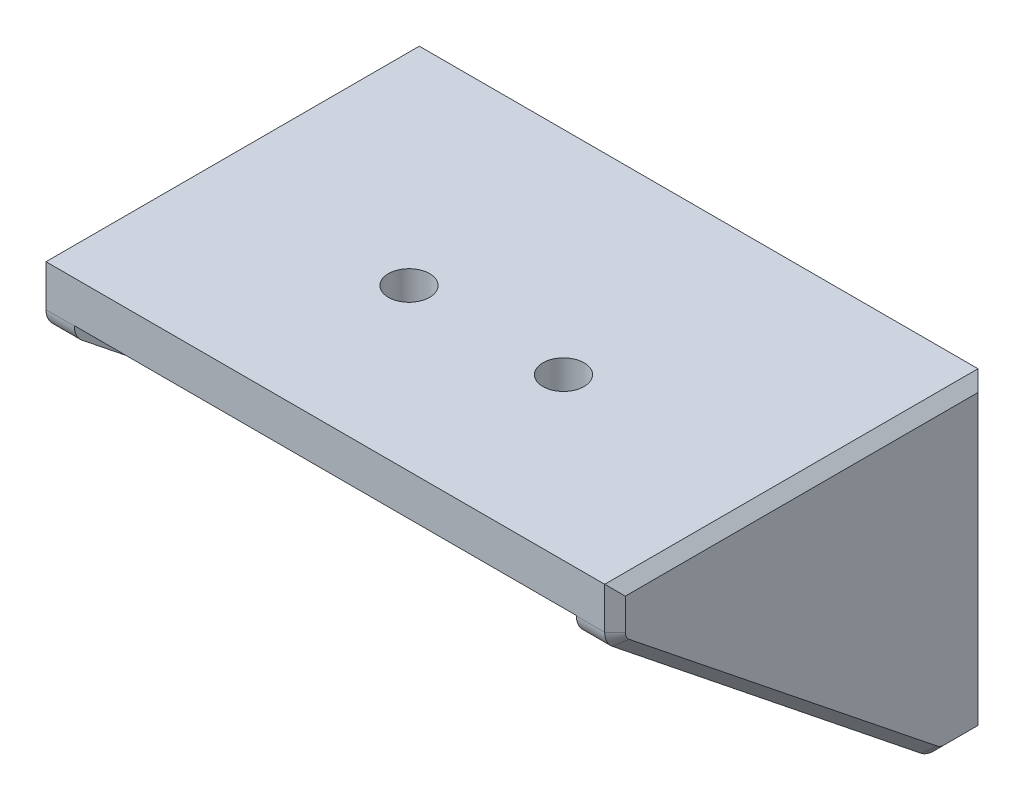
from build123d import *

# Parameters (mm, degrees)
SKETCH_1_W          = 39
SKETCH_1_H          = 29
SKETCH_1_R          = 1.6
EXTRUDE_1_DEPTH     = 4
SKETCH_2_W          = 39
SKETCH_2_H          = 4
EXTRUDE_2_DEPTH     = 20
SKETCH_3_R          = 1.35
CUT_EXTRUDE_1_DEPTH = 4
EXTRUDE_3_DEPTH     = 3
CHAMFER_1_SIZE      = 0.8
FILLET_1_R          = 1.6
CHAMFER_3_SIZE      = 0.8


with BuildPart() as part:
    # 草图1 → 凸台-拉伸1 (new body)
    with BuildSketch(Plane(origin=(0, 0, 0), x_dir=(1, 0, 0), z_dir=(0, 1, 0))):
        Rectangle(SKETCH_1_W, SKETCH_1_H)
        with Locations(Location((-6, -2, 0), (0, 0, 270))):
            Circle(SKETCH_1_R, mode=Mode.SUBTRACT)
        with Locations(Location((6, -2, 0), (0, 0, 90))):
            Circle(SKETCH_1_R, mode=Mode.SUBTRACT)
    extrude(amount=EXTRUDE_1_DEPTH)

    # 草图2 → 凸台-拉伸2 (add)
    with BuildSketch(Plane(origin=(0, 0, 0), x_dir=(-1, 0, 0), z_dir=(0, -1, 0))):
        with Locations((0, 12.5)):
            Rectangle(SKETCH_2_W, SKETCH_2_H)
    extrude(amount=EXTRUDE_2_DEPTH)

    # 草图3 → 切除-拉伸1 (cut)
    with BuildSketch(Plane.XY.offset(-10.5)):
        with Locations((16, -4)):
            Circle(SKETCH_3_R)
        with Locations(Location((16, -16, 0), (0, 0, 180))):
            Circle(SKETCH_3_R)
        with Locations((-16, -16)):
            Circle(SKETCH_3_R)
        with Locations(Location((-16, -4, 0), (0, 0, 180))):
            Circle(SKETCH_3_R)
    extrude(amount=-CUT_EXTRUDE_1_DEPTH, mode=Mode.SUBTRACT)

    # 草图4 → 凸台-拉伸3 (add)
    with BuildSketch(Plane(origin=(19.5, 0, 0), x_dir=(0, 0, -1), z_dir=(1, 0, 0))):
        Polygon((-14.5, 0), (10.5, -20), (14.5, -20), (14.5, 4), (-14.5, 4), align=None)
    extrude_3 = extrude(amount=EXTRUDE_3_DEPTH)

    # 镜向1: 凸台-拉伸3 across plane
    add(extrude_3.mirror(Plane(origin=(0, 0, 0), x_dir=(0, 0, 1), z_dir=(1, 0, 0))))

    # 倒角1
    chamfer_1_edges = [part.edges().sort_by_distance(p)[0] for p in [
        (0, -20, -10.5),
        (0, -20, -14.5),
        (0, 0, 14.5),
        (22.5, -8, -14.5),
        (22.5, 4, 0),
        (-22.5, 4, 0),
        (-22.5, -8, -14.5),
    ]]
    chamfer(chamfer_1_edges, length=CHAMFER_1_SIZE)

    # 圆角1
    fillet_1_edges = [part.edges().sort_by_distance(p)[0] for p in [
        (21, 0, 14.5),
        (21, -20, -10.5),
        (-21, 0, 14.5),
        (-21, -20, -10.5),
    ]]
    fillet(fillet_1_edges, radius=FILLET_1_R)

    # 倒角3
    chamfer_3_edges = [part.edges().sort_by_distance(p)[0] for p in [
        (22.5, 1.984499878, 14.5),
        (22.5, -20, -12.380624847),
        (22.5, 0.075897787, 14.342085178),
        (22.5, -19.909805311, -10.531638589),
        (22.5, -10.064890217, 1.918887229),
        (-22.5, -20, -12.380624847),
        (-22.5, -19.909805311, -10.531638589),
        (-22.5, -10.064890217, 1.918887229),
        (-22.5, 0.075897787, 14.342085178),
        (-22.5, 1.984499878, 14.5),
    ]]
    chamfer(chamfer_3_edges, length=CHAMFER_3_SIZE)


solid = part.part
